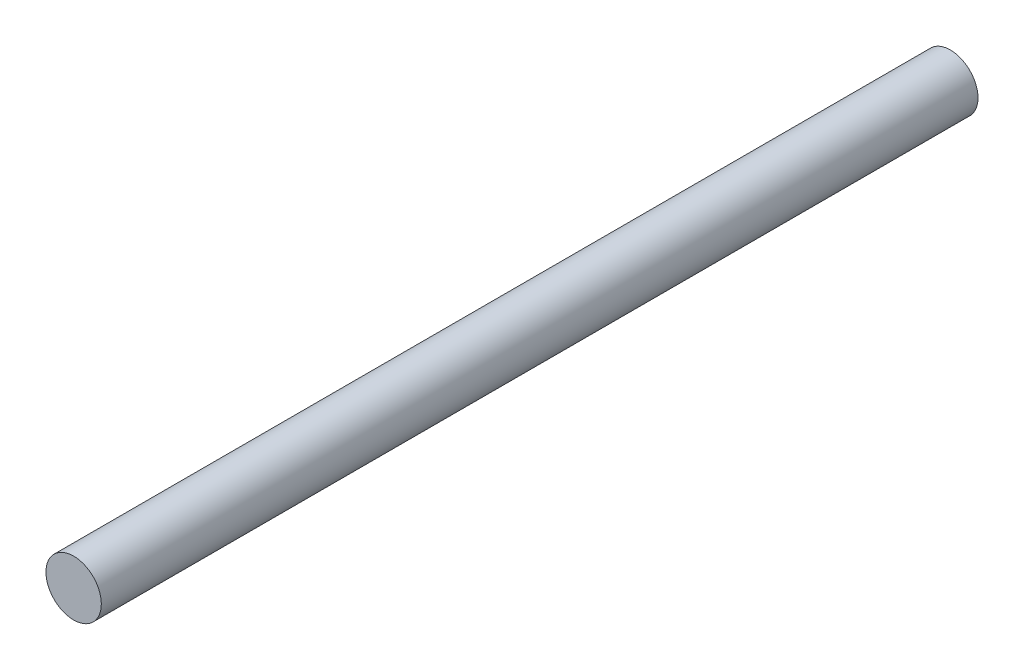
from build123d import *

# Parameters (mm, degrees)
ESBO_O1_R                = 3
RESSALTO_EXTRUS_O1_DEPTH = 95


with BuildPart() as part:
    # Esboço1 → Ressalto-extrusão1 (new body)
    with BuildSketch(Plane.XY):
        Circle(ESBO_O1_R)
    extrude(amount=RESSALTO_EXTRUS_O1_DEPTH)


solid = part.part
